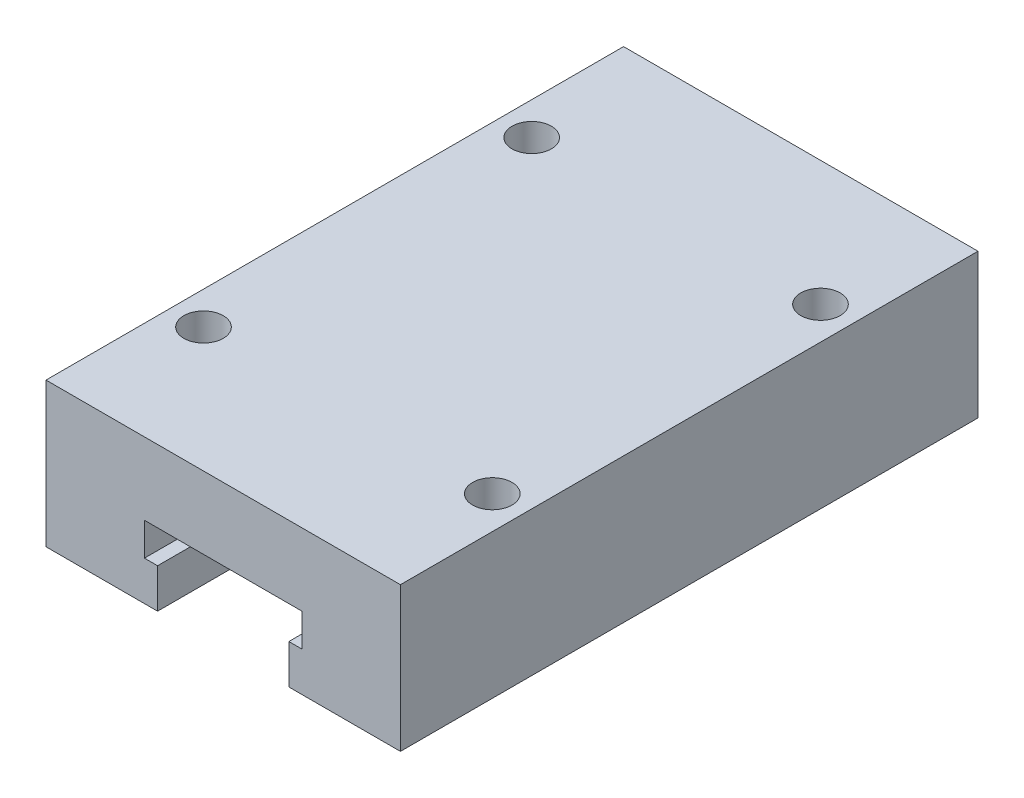
from build123d import *

# Parameters (mm, degrees)
BOSS_EXTRUDE1_DEPTH = 44
SKETCH2_R           = 1.5
CUT_EXTRUDE1_DEPTH  = 4


with BuildPart() as part:
    # Sketch1 → Boss-Extrude1 (new body)
    with BuildSketch(Plane.XY):
        Polygon((19.5, 5.5), (19.5, 3), (18.5, 3), (18.5, 0), (27, 0), (27, 11), (0, 11), (0, 0), (8.5, 0), (8.5, 3), (7.5, 3), (7.5, 5.5), align=None)
    extrude(amount=BOSS_EXTRUDE1_DEPTH)

    # Sketch2 → Cut-Extrude1 (cut)
    with BuildSketch(Plane(origin=(0, 11, 0), x_dir=(1, 0, 0), z_dir=(0, 1, 0))):
        with Locations(Location((2.5, -9.5, 0), (0, 0, 180))):
            Circle(SKETCH2_R)
        with Locations(Location((24.5, -9.5, 0), (0, 0, 180))):
            Circle(SKETCH2_R)
        with Locations(Location((24.5, -34.5, 0), (0, 0, 180))):
            Circle(SKETCH2_R)
        with Locations(Location((2.5, -34.5, 0), (0, 0, 180))):
            Circle(SKETCH2_R)
    extrude(amount=-CUT_EXTRUDE1_DEPTH, mode=Mode.SUBTRACT)


solid = part.part
